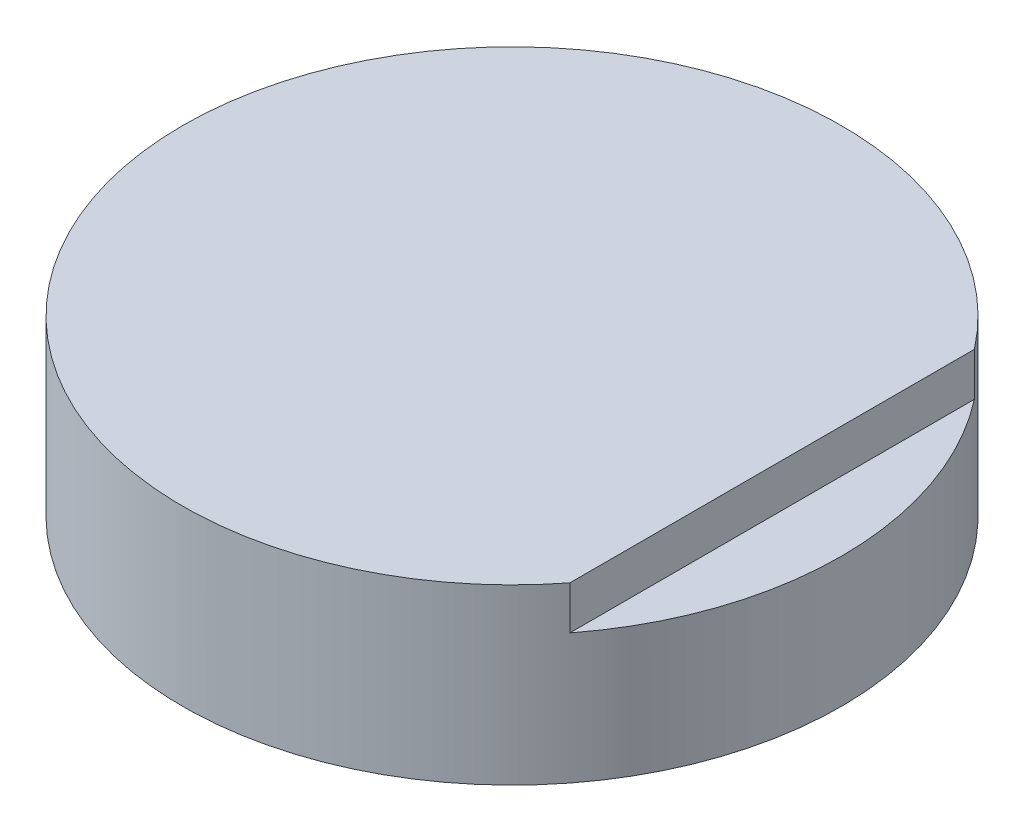
from build123d import *

# Parameters (mm, degrees)
KEYED_BACK_DEPTH   = 0.5
CUP_BLANK_SKETCH_R = 3.8
CUP_BLANK_DEPTH    = 1.5


with BuildPart() as part:
    # Keyed Back Sketch → Keyed Back (new body)
    with BuildSketch(Plane(origin=(0, -69, 0), x_dir=(-1, 0, 0), z_dir=(0, -1, 0))):
        with BuildLine():
            Line((23.291651246, 2.332380758), (23.291651246, -2.332380758))
            ThreePointArc((23.291651246, -2.332380758), (30.091651246, 0), (23.291651246, 2.332380758))
        make_face()
    extrude(amount=KEYED_BACK_DEPTH)

    # Cup Blank Sketch → Cup Blank (add)
    with BuildSketch(Plane(origin=(0, -69.5, 0), x_dir=(-1, 0, 0), z_dir=(0, -1, 0))):
        with Locations(Location((26.291651246, 0, 0), (0, 0, 217.863646362))):
            Circle(CUP_BLANK_SKETCH_R)
    extrude(amount=CUP_BLANK_DEPTH)

    # Spherical Bearing Seat profile → Spherical Bearing Seat (revolve, cut)
    with BuildSketch(Plane(origin=(0, -73, 0), x_dir=(-1, 0, 0), z_dir=(0, -1, 0))):
        with BuildLine():
            Line((26.291651246, -3.1), (26.291651246, 3.1))
            ThreePointArc((26.291651246, 3.1), (23.191651246, 0), (26.291651246, -3.1))
        make_face()
    revolve(axis=Axis((-26.291651246, -73, -10), (0, 0, 1)), mode=Mode.SUBTRACT)


solid = part.part
